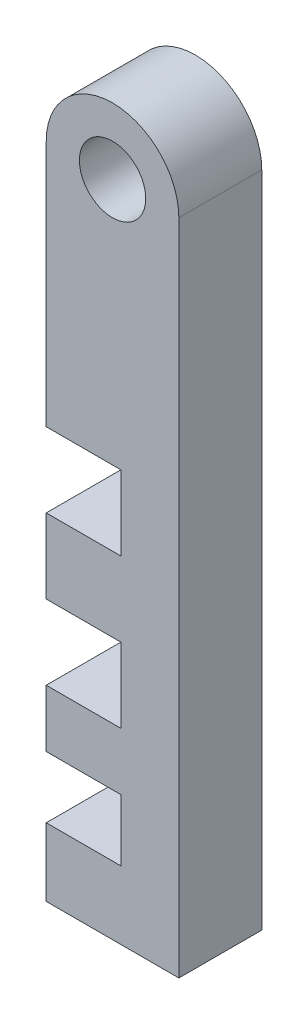
from build123d import *

# Parameters (mm, degrees)
ESQUISSE1_R        = 2
BOSS_EXTRU_1_DEPTH = 5


with BuildPart() as part:
    # Esquisse1 → Boss.-Extru.1 (new body)
    with BuildSketch(Plane.XY):
        with BuildLine():
            Line((-60.818649801, 1.004609912), (-60.818649801, 11.306245912))
            ThreePointArc((-60.818649801, 11.306245912), (-56.818649801, 15.306245912), (-52.818649801, 11.306245912))
            Line((-52.818649801, 11.306245912), (-52.818649801, -28.402433088))
            Line((-52.818649801, -28.402433088), (-60.818649801, -28.402433088))
            Line((-60.818649801, -28.402433088), (-60.818649801, -24.294096088))
            Line((-60.818649801, -24.294096088), (-56.318649801, -24.294096088))
            Line((-56.318649801, -24.294096088), (-56.318649801, -20.573332088))
            Line((-56.318649801, -20.573332088), (-60.818649801, -20.573332088))
            Line((-60.818649801, -20.573332088), (-60.818649801, -17.109221088))
            Line((-60.818649801, -17.109221088), (-56.318649801, -17.109221088))
            Line((-56.318649801, -17.109221088), (-56.318649801, -12.609221088))
            Line((-56.318649801, -12.609221088), (-60.818649801, -12.609221088))
            Line((-60.818649801, -12.609221088), (-60.818649801, -8.109221088))
            Line((-60.818649801, -8.109221088), (-56.318649801, -8.109221088))
            Line((-56.318649801, -8.109221088), (-56.318649801, -3.609221088))
            Line((-56.318649801, -3.609221088), (-60.818649801, -3.609221088))
            Line((-60.818649801, -3.609221088), (-60.818649801, 1.004609912))
        make_face()
        with Locations((-56.818649801, 11.306245912)):
            Circle(ESQUISSE1_R, mode=Mode.SUBTRACT)
    extrude(amount=BOSS_EXTRU_1_DEPTH)


solid = part.part
